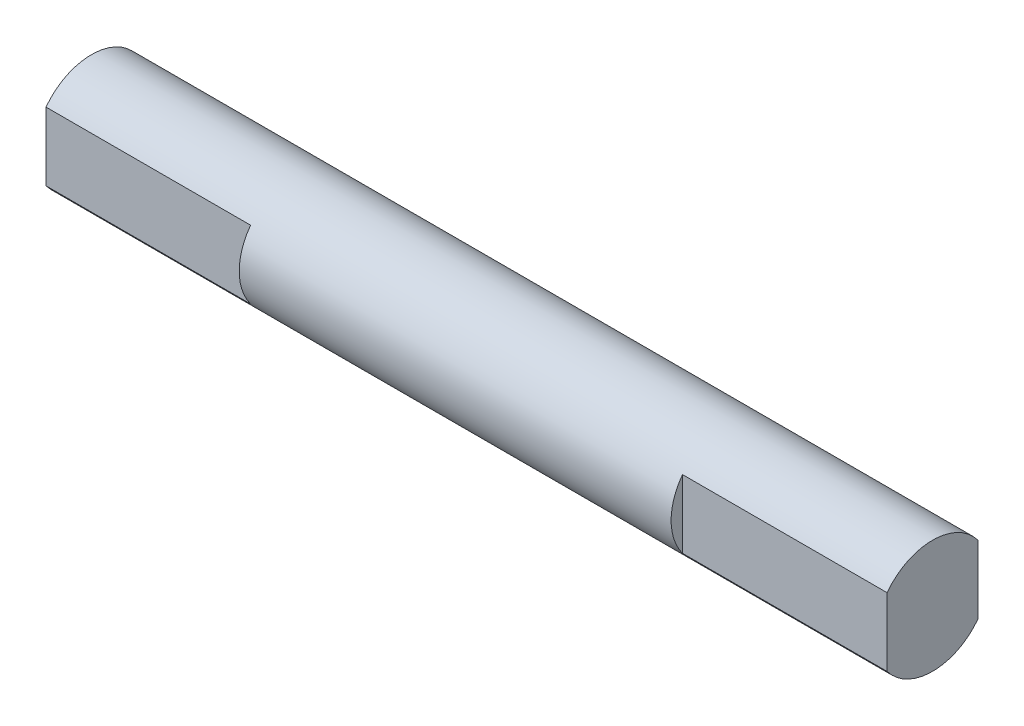
from build123d import *

# Parameters (mm, degrees)
SKETCH1_R           = 2.5
BOSS_EXTRUDE1_DEPTH = 9.5
BOSS_EXTRUDE2_START = 9
BOSS_EXTRUDE2_DEPTH = 9


with BuildPart() as part:
    # Sketch1 → Boss-Extrude1 (new, symmetric)
    with BuildSketch(Plane(origin=(0, 0, 0), x_dir=(0, 0, -1), z_dir=(1, 0, 0))):
        Circle(SKETCH1_R)
    extrude(amount=BOSS_EXTRUDE1_DEPTH, both=True)

    # Sketch2 → Boss-Extrude2 (add)
    with BuildSketch(Plane(origin=(9.5, 0, 0), x_dir=(0, 0, -1), z_dir=(1, 0, 0)).offset(BOSS_EXTRUDE2_START)):
        with BuildLine():
            Line((-2, 1.5), (-2, -1.5))
            ThreePointArc((-2, -1.5), (0, -2.5), (2, -1.5))
            Line((2, -1.5), (2, 1.5))
            ThreePointArc((2, 1.5), (0, 2.5), (-2, 1.5))
        make_face()
    boss_extrude2 = extrude(amount=-BOSS_EXTRUDE2_DEPTH)

    # Mirror1: Boss-Extrude2 across plane
    add(boss_extrude2.mirror(Plane(origin=(0, 0, 0), x_dir=(0, 0, 1), z_dir=(1, 0, 0))))


solid = part.part
